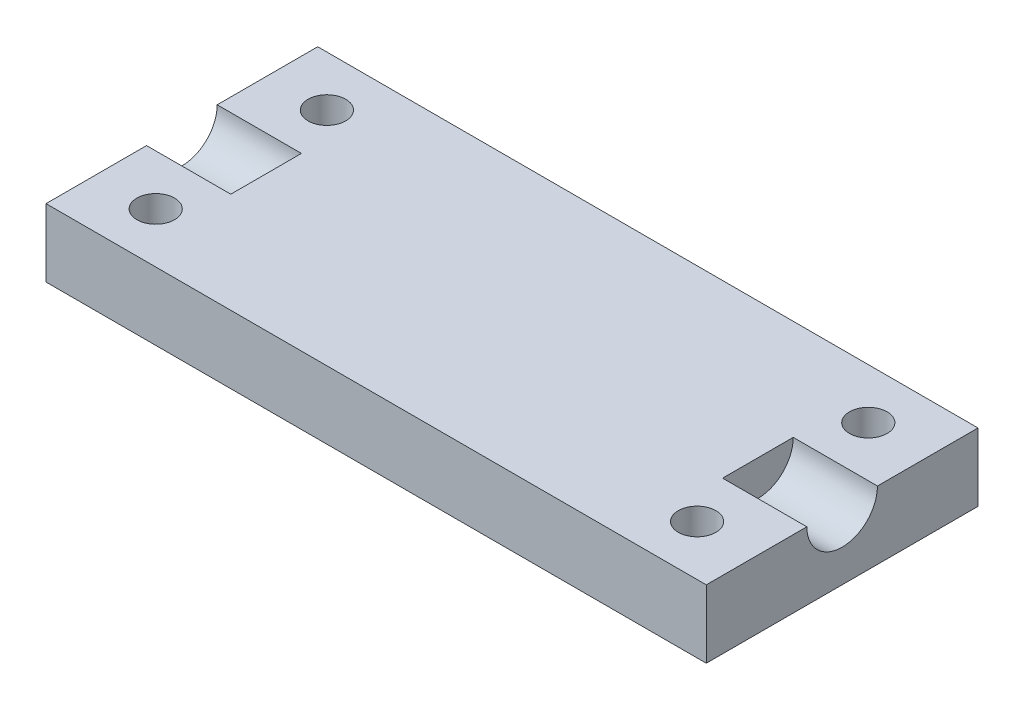
from build123d import *

# Parameters (mm, degrees)
SKETCH1_W           = 61.722
SKETCH1_H           = 25.4
BOSS_EXTRUDE1_DEPTH = 6.35
SKETCH2_R           = 3.302
CUT_EXTRUDE1_DEPTH  = 7.874
CUT_EXTRUDE2_START  = -7.874
SKETCH3_R           = 3.302
CUT_EXTRUDE2_DEPTH  = 7.874
CUT_EXTRUDE11_REACH = 35.971
SKETCH4_R           = 1.75895


with BuildPart() as part:
    # Sketch1 → Boss-Extrude1 (new body)
    with BuildSketch(Plane(origin=(0, 0, 0), x_dir=(1, 0, 0), z_dir=(0, 1, 0))):
        Rectangle(SKETCH1_W, SKETCH1_H)
    extrude(amount=-BOSS_EXTRUDE1_DEPTH)

    # Sketch2 → Cut-Extrude1 (cut)
    with BuildSketch(Plane(origin=(30.861, 0, 0), x_dir=(0, 0, -1), z_dir=(1, 0, 0))):
        Circle(SKETCH2_R)
    extrude(amount=-CUT_EXTRUDE1_DEPTH, mode=Mode.SUBTRACT)

    # Sketch3 → Cut-Extrude2 (cut)
    with BuildSketch(Plane.ZY.offset(30.861).offset(CUT_EXTRUDE2_START)):
        Circle(SKETCH3_R)
    extrude(amount=CUT_EXTRUDE2_DEPTH, mode=Mode.SUBTRACT)

    # Sketch4 → Cut-Extrude11 (cut, up to next)
    with BuildSketch(Plane(origin=(0, 0, 0), x_dir=(1, 0, 0), z_dir=(0, 1, 0)), mode=Mode.PRIVATE) as cut_extrude11_sk1:
        with Locations(Location((25.30475, -8.001, 0), (0, 0, 270))):
            Circle(SKETCH4_R)
    cut_extrude11_tool1 = extrude(cut_extrude11_sk1.sketch, amount=-CUT_EXTRUDE11_REACH, mode=Mode.PRIVATE) & part.part
    # Sketch4 → Cut-Extrude11 (cut, up to next)
    with BuildSketch(Plane(origin=(0, 0, 0), x_dir=(1, 0, 0), z_dir=(0, 1, 0)), mode=Mode.PRIVATE) as cut_extrude11_sk2:
        with Locations(Location((25.30475, 8.001, 0), (0, 0, 270))):
            Circle(SKETCH4_R)
    cut_extrude11_tool2 = extrude(cut_extrude11_sk2.sketch, amount=-CUT_EXTRUDE11_REACH, mode=Mode.PRIVATE) & part.part
    # Sketch4 → Cut-Extrude11 (cut, up to next)
    with BuildSketch(Plane(origin=(0, 0, 0), x_dir=(1, 0, 0), z_dir=(0, 1, 0)), mode=Mode.PRIVATE) as cut_extrude11_sk3:
        with Locations(Location((-25.30475, 8.001, 0), (0, 0, 270))):
            Circle(SKETCH4_R)
    cut_extrude11_tool3 = extrude(cut_extrude11_sk3.sketch, amount=-CUT_EXTRUDE11_REACH, mode=Mode.PRIVATE) & part.part
    # Sketch4 → Cut-Extrude11 (cut, up to next)
    with BuildSketch(Plane(origin=(0, 0, 0), x_dir=(1, 0, 0), z_dir=(0, 1, 0)), mode=Mode.PRIVATE) as cut_extrude11_sk4:
        with Locations(Location((-25.30475, -8.001, 0), (0, 0, 270))):
            Circle(SKETCH4_R)
    cut_extrude11_tool4 = extrude(cut_extrude11_sk4.sketch, amount=-CUT_EXTRUDE11_REACH, mode=Mode.PRIVATE) & part.part
    add(cut_extrude11_tool1.solids().sort_by_distance((25.30475, 0, 8.001))[0], mode=Mode.SUBTRACT)
    add(cut_extrude11_tool2.solids().sort_by_distance((25.30475, 0, -8.001))[0], mode=Mode.SUBTRACT)
    add(cut_extrude11_tool3.solids().sort_by_distance((-25.30475, 0, -8.001))[0], mode=Mode.SUBTRACT)
    add(cut_extrude11_tool4.solids().sort_by_distance((-25.30475, 0, 8.001))[0], mode=Mode.SUBTRACT)


solid = part.part
